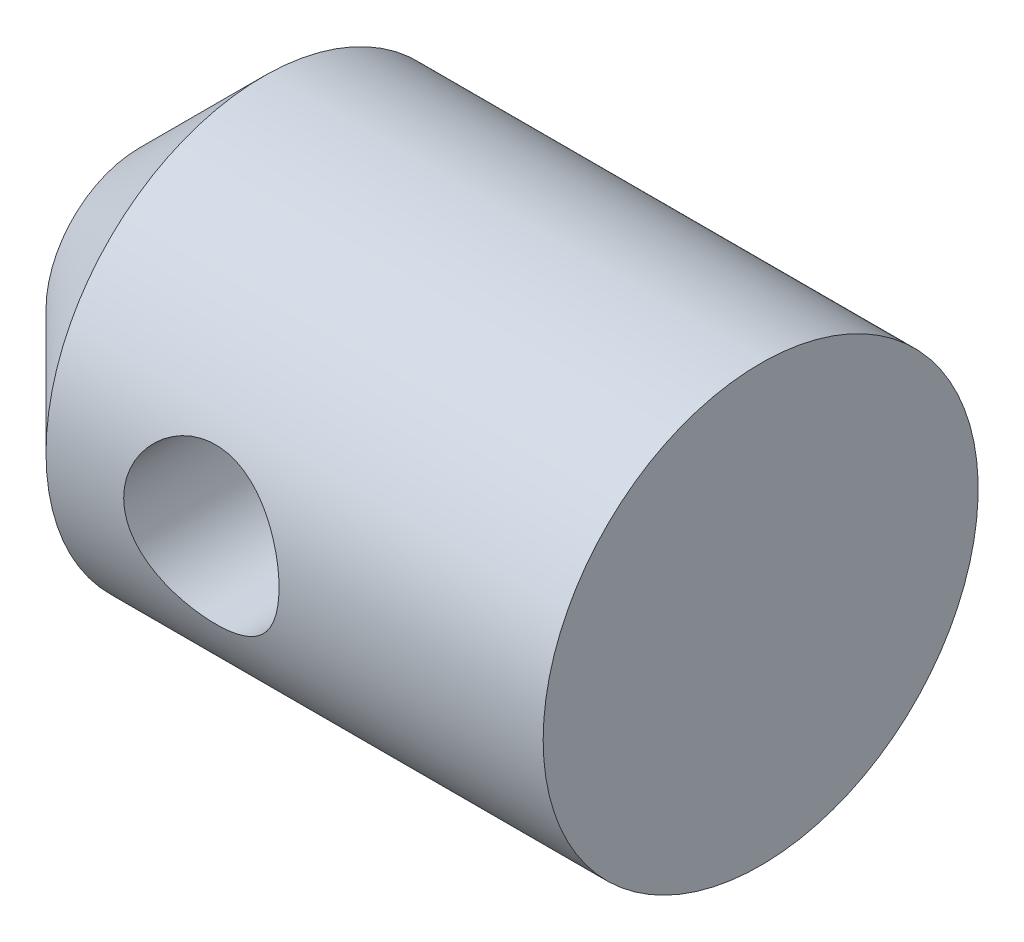
from build123d import *

# Parameters (mm, degrees)
SKETCH2_R               = 1
CUT_EXTRUDE1_DEPTH      = 15
CUT_EXTRUDE2_DEPTH      = 26.396850198
CUT_EXTRUDE2_DEPTH_BACK = 26.396850198
SKETCH3_R               = 2.5


with BuildPart() as part:
    # Sketch1 → Revolve1 (revolve)
    with BuildSketch(Plane.XY, mode=Mode.PRIVATE) as revolve1_sk:
        Polygon((0, 3), (0, 0), (20, 0), (20, 7), (4, 7), align=None)
    revolve(revolve1_sk.sketch.rotate(Axis((0, 0, 0), (1, 0, 0)), 90), axis=Axis((0, 0, 0), (1, 0, 0)))

    # Sketch2 → Cut-Extrude1 (cut)
    with BuildSketch(Plane.ZY):
        Circle(SKETCH2_R)
    extrude(amount=-CUT_EXTRUDE1_DEPTH, mode=Mode.SUBTRACT)

    # Sketch3 → Cut-Extrude2 (cut, two sides: drawn at the far end of the back side and taken through both)
    with BuildSketch(Plane.XY.offset(7).offset(-CUT_EXTRUDE2_DEPTH_BACK)):
        with Locations((9, 0)):
            Circle(SKETCH3_R)
    extrude(amount=CUT_EXTRUDE2_DEPTH + CUT_EXTRUDE2_DEPTH_BACK, mode=Mode.SUBTRACT)


solid = part.part
